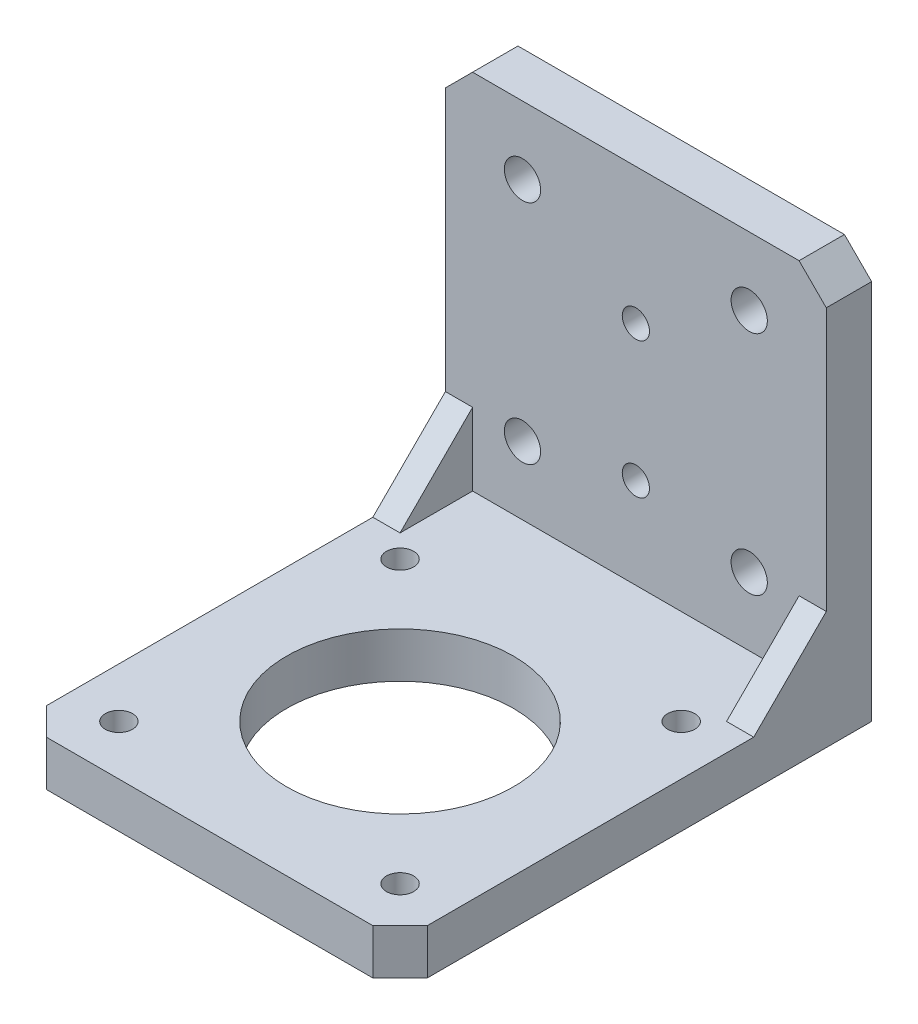
from build123d import *

# Parameters (mm, degrees)
SKETCH1_W           = 42
SKETCH1_H           = 47
BOSS_EXTRUDE1_DEPTH = 5
SKETCH2_R           = 1.5
SKETCH2_R_2         = 12.5
CUT_EXTRUDE1_DEPTH  = 32.910029771
SKETCH4_W           = 42
SKETCH4_H           = 45
BOSS_EXTRUDE2_DEPTH = 5
BOSS_EXTRUDE3_DEPTH = 3
BOSS_EXTRUDE4_DEPTH = 3
SKETCH9_R           = 2
CUT_EXTRUDE4_DEPTH  = 69.373971656
CHAMFER3_SIZE       = 3
CUT_EXTRUDE5_REACH  = 73.903
SKETCH10_R          = 1.5


with BuildPart() as part:
    # Sketch1 → Boss-Extrude1 (new body)
    with BuildSketch(Plane(origin=(0, 0, 0), x_dir=(1, 0, 0), z_dir=(0, 1, 0))):
        Rectangle(SKETCH1_W, SKETCH1_H)
    extrude(amount=BOSS_EXTRUDE1_DEPTH)

    # Sketch2 → Cut-Extrude1 (cut, through all)
    with BuildSketch(Plane(origin=(0, 5, 0), x_dir=(1, 0, 0), z_dir=(0, 1, 0))):
        with Locations(Location((-15.5, 13, 0), (0, 0, 270))):
            Circle(SKETCH2_R)
        with Locations(Location((15.5, 13, 0), (0, 0, 270))):
            Circle(SKETCH2_R)
        with Locations(Location((15.5, -18, 0), (0, 0, 270))):
            Circle(SKETCH2_R)
        with Locations(Location((-15.5, -18, 0), (0, 0, 270))):
            Circle(SKETCH2_R)
        with Locations(Location((0, -2.5, 0), (0, 0, 270))):
            Circle(SKETCH2_R_2)
    extrude(amount=-CUT_EXTRUDE1_DEPTH, mode=Mode.SUBTRACT)

    # Sketch4 → Boss-Extrude2 (add)
    with BuildSketch(Plane(origin=(0, 0, -23.5), x_dir=(-1, 0, 0), z_dir=(0, 0, -1))):
        with Locations((0, 22.5)):
            Rectangle(SKETCH4_W, SKETCH4_H)
    extrude(amount=BOSS_EXTRUDE2_DEPTH)

    # Sketch5 → Boss-Extrude3 (add)
    with BuildSketch(Plane(origin=(21, 0, 0), x_dir=(0, 0, -1), z_dir=(1, 0, 0))):
        Polygon((23.5, 13), (15.5, 5), (23.5, 5), align=None)
    extrude(amount=-BOSS_EXTRUDE3_DEPTH)

    # Sketch6 → Boss-Extrude4 (add)
    with BuildSketch(Plane.ZY.offset(21)):
        Polygon((-23.5, 13), (-15.5, 5), (-23.5, 5), align=None)
    extrude(amount=-BOSS_EXTRUDE4_DEPTH)

    # Sketch9 → Cut-Extrude4 (cut, through all)
    with BuildSketch(Plane.XY.offset(-23.5)):
        with Locations((-12.5, 37.5)):
            Circle(SKETCH9_R)
        with Locations((12.5, 37.5)):
            Circle(SKETCH9_R)
        with Locations((12.5, 12.5)):
            Circle(SKETCH9_R)
        with Locations((-12.5, 12.5)):
            Circle(SKETCH9_R)
    extrude(amount=-CUT_EXTRUDE4_DEPTH, mode=Mode.SUBTRACT)

    # Chamfer3
    chamfer3_edges = [part.edges().sort_by_distance(p)[0] for p in [
        (-21, 2.5, 23.5),
        (21, 2.5, 23.5),
        (21, 45, -26),
        (-21, 45, -26),
    ]]
    chamfer(chamfer3_edges, length=CHAMFER3_SIZE)

    # Sketch10 → Cut-Extrude5 (cut, up to next)
    with BuildSketch(Plane(origin=(0, 0, -28.5), x_dir=(-1, 0, 0), z_dir=(0, 0, -1)), mode=Mode.PRIVATE) as cut_extrude5_sk1:
        with Locations((0, 30)):
            Circle(SKETCH10_R)
    cut_extrude5_tool1 = extrude(cut_extrude5_sk1.sketch, amount=-CUT_EXTRUDE5_REACH, mode=Mode.PRIVATE) & part.part
    # Sketch10 → Cut-Extrude5 (cut, up to next)
    with BuildSketch(Plane(origin=(0, 0, -28.5), x_dir=(-1, 0, 0), z_dir=(0, 0, -1)), mode=Mode.PRIVATE) as cut_extrude5_sk2:
        with Locations((0, 15)):
            Circle(SKETCH10_R)
    cut_extrude5_tool2 = extrude(cut_extrude5_sk2.sketch, amount=-CUT_EXTRUDE5_REACH, mode=Mode.PRIVATE) & part.part
    add(cut_extrude5_tool1.solids().sort_by_distance((0, 30, -28.5))[0], mode=Mode.SUBTRACT)
    add(cut_extrude5_tool2.solids().sort_by_distance((0, 15, -28.5))[0], mode=Mode.SUBTRACT)


solid = part.part
